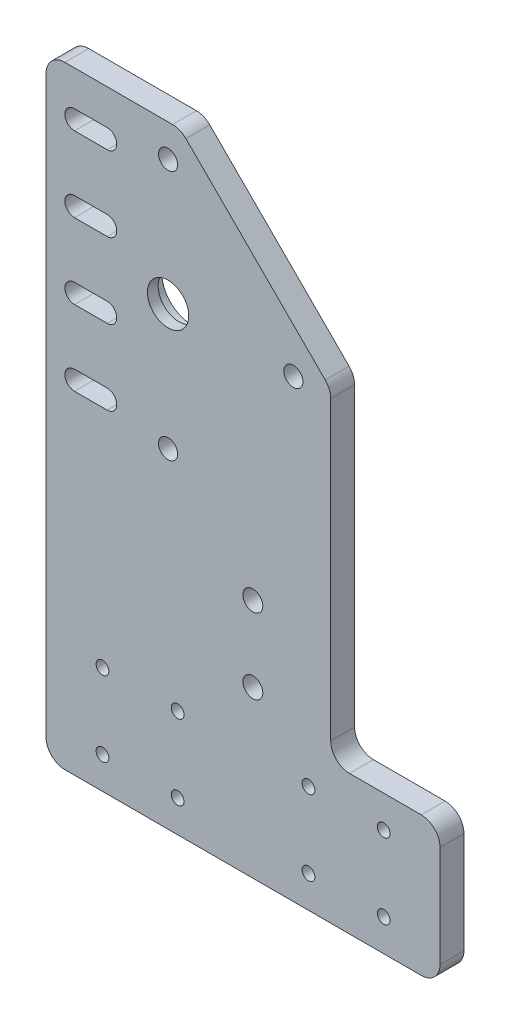
from build123d import *

# Parameters (mm, degrees)
CROQUIS1_R          = 1.7
CROQUIS1_R_2        = 2.65
CROQUIS1_R_3        = 5.5
CROQUIS1_R_4        = 2.55
EXTRUDE_1_DEPTH     = 6.35
EXTRUDE_START       = -6.35
CROQUIS2_R          = 8.025
EXTRUDE_CUT_1_DEPTH = 3.5


with BuildPart() as part:
    # Croquis1 → Extrude 1 (new body)
    with BuildSketch(Plane.XY):
        with BuildLine():
            Line((-65, -34), (-65, 86.95))
            ThreePointArc((-65, 86.95), (-63.535533906, 90.485533906), (-60, 91.95))
            Line((-60, 91.95), (-31.351067812, 91.95))
            ThreePointArc((-31.351067812, 91.95), (-29.43765065, 91.569397663), (-27.815533906, 90.485533906))
            Line((-27.815533906, 90.485533906), (9.255533906, 53.414466094))
            ThreePointArc((9.255533906, 53.414466094), (10.339397663, 51.79234935), (10.72, 49.878932188))
            Line((10.72, 49.878932188), (10.72, -29))
            ThreePointArc((10.72, -29), (12.184466094, -32.535533906), (15.72, -34))
            Line((15.72, -34), (34.8, -34))
            ThreePointArc((34.8, -34), (38.335533906, -35.464466094), (39.8, -39))
            Line((39.8, -39), (39.8, -66))
            ThreePointArc((39.8, -66), (38.335533906, -69.535533906), (34.8, -71))
            Line((34.8, -71), (-60, -71))
            ThreePointArc((-60, -71), (-63.535533906, -69.535533906), (-65, -66))
            Line((-65, -66), (-65, -34))
        make_face()
        with Locations((-50, -42.5)):
            Circle(CROQUIS1_R, mode=Mode.SUBTRACT)
        with Locations((-30, -42.5)):
            Circle(CROQUIS1_R, mode=Mode.SUBTRACT)
        with Locations((-30, -62.5)):
            Circle(CROQUIS1_R, mode=Mode.SUBTRACT)
        with Locations((-50, -62.5)):
            Circle(CROQUIS1_R, mode=Mode.SUBTRACT)
        with Locations((4.8, -62.5)):
            Circle(CROQUIS1_R, mode=Mode.SUBTRACT)
        with Locations((4.8, -42.5)):
            Circle(CROQUIS1_R, mode=Mode.SUBTRACT)
        with Locations((24.8, -42.5)):
            Circle(CROQUIS1_R, mode=Mode.SUBTRACT)
        with Locations((24.8, -62.5)):
            Circle(CROQUIS1_R, mode=Mode.SUBTRACT)
        with Locations((-10, -7)):
            Circle(CROQUIS1_R_2, mode=Mode.SUBTRACT)
        with Locations((-10, -27)):
            Circle(CROQUIS1_R_2, mode=Mode.SUBTRACT)
        with Locations((-32.55, 50)):
            Circle(CROQUIS1_R_3, mode=Mode.SUBTRACT)
        with Locations((-32.55, 16.666986335)):
            Circle(CROQUIS1_R_4, mode=Mode.SUBTRACT)
        with Locations((-32.55, 83.333013665)):
            Circle(CROQUIS1_R_4, mode=Mode.SUBTRACT)
        with Locations((0.783013665, 50)):
            Circle(CROQUIS1_R_4, mode=Mode.SUBTRACT)
        with BuildLine():
            Line((-57.45, 22.55), (-48.75, 22.55))
            ThreePointArc((-48.75, 22.55), (-46.2, 20), (-48.75, 17.45))
            Line((-48.75, 17.45), (-57.45, 17.45))
            ThreePointArc((-57.45, 17.45), (-60, 20), (-57.45, 22.55))
        make_face(mode=Mode.SUBTRACT)
        with BuildLine():
            Line((-57.45, 82.55), (-48.75, 82.55))
            ThreePointArc((-48.75, 82.55), (-46.2, 80), (-48.75, 77.45))
            Line((-48.75, 77.45), (-57.45, 77.45))
            ThreePointArc((-57.45, 77.45), (-60, 80), (-57.45, 82.55))
        make_face(mode=Mode.SUBTRACT)
        with BuildLine():
            Line((-57.45, 62.55), (-48.75, 62.55))
            ThreePointArc((-48.75, 62.55), (-46.2, 60), (-48.75, 57.45))
            Line((-48.75, 57.45), (-57.45, 57.45))
            ThreePointArc((-57.45, 57.45), (-60, 60), (-57.45, 62.55))
        make_face(mode=Mode.SUBTRACT)
        with BuildLine():
            Line((-57.45, 42.55), (-48.75, 42.55))
            ThreePointArc((-48.75, 42.55), (-46.2, 40), (-48.75, 37.45))
            Line((-48.75, 37.45), (-57.45, 37.45))
            ThreePointArc((-57.45, 37.45), (-60, 40), (-57.45, 42.55))
        make_face(mode=Mode.SUBTRACT)
    extrude(amount=EXTRUDE_1_DEPTH)

    # Croquis2 → Extrude Cut 1 (cut)
    with BuildSketch(Plane.XY.offset(6.35).offset(EXTRUDE_START)):
        with Locations(Location((-32.55, 50, 0), (0, 0, 180))):
            Circle(CROQUIS2_R)
    extrude(amount=EXTRUDE_CUT_1_DEPTH, mode=Mode.SUBTRACT)


solid = part.part
